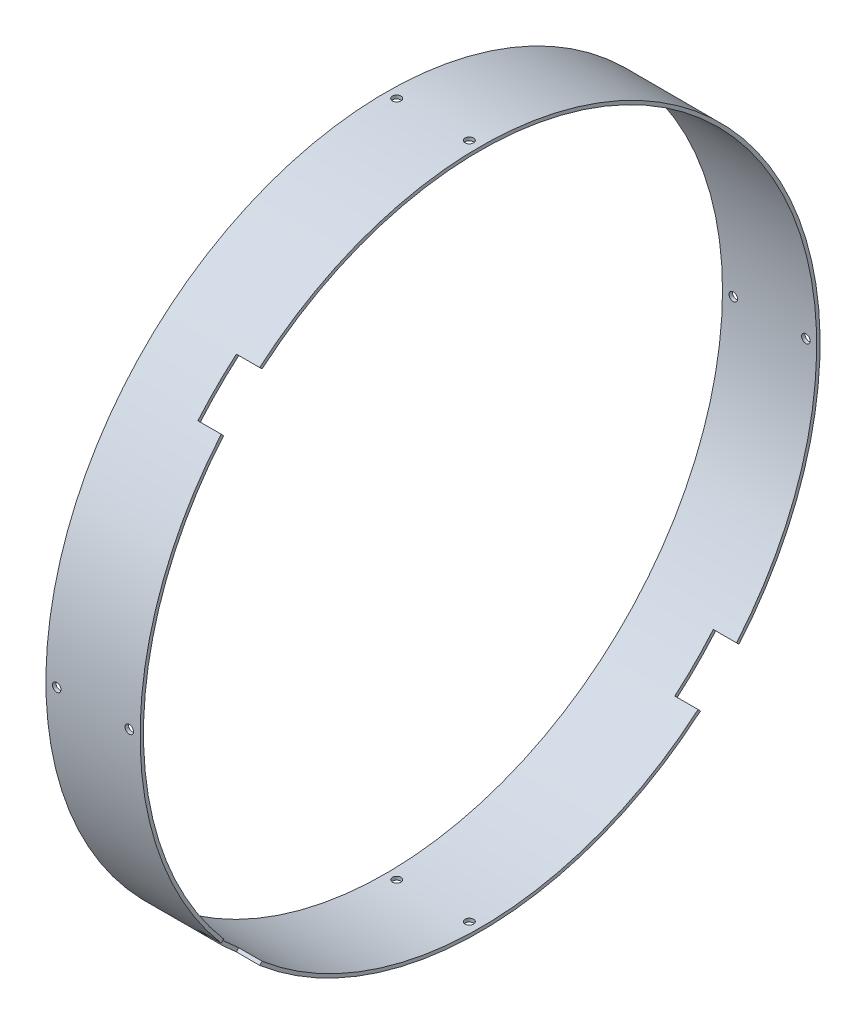
from build123d import *

# Parameters (mm, degrees)
SKETCH1_R               = 100
SKETCH1_R_2             = 99
BOSS_EXTRUDE1_DEPTH     = 27.7
F_2_5MM_DOWEL_HOLE1_D   = 2.5
F_2_5MM_DOWEL_HOLE2_D   = 2.5
SKETCH6_W               = 7.35
SKETCH6_H               = 16
CUT_EXTRUDE1_DEPTH      = 145.108605038
CUT_EXTRUDE2_DEPTH      = 145.108605038
CUT_EXTRUDE2_DEPTH_BACK = 145.108605038
SKETCH7_W               = 7.35
SKETCH7_H               = 16


with BuildPart() as part:
    # Sketch1 → Boss-Extrude1 (new body)
    with BuildSketch(Plane(origin=(0, 0, 0), x_dir=(0, 0, -1), z_dir=(1, 0, 0))):
        Circle(SKETCH1_R)
        Circle(SKETCH1_R_2, mode=Mode.SUBTRACT)
    extrude(amount=BOSS_EXTRUDE1_DEPTH)

    # Ø2.5mm Dowel Hole1 (through all)
    with Locations(Plane.XY.offset(100)):
        with Locations((24.525, 0), (3.175, 0)):
            Hole(F_2_5MM_DOWEL_HOLE1_D / 2)

    # Ø2.5mm Dowel Hole2 (through all)
    with Locations(Plane(origin=(0, 100, 0), x_dir=(1, 0, 0), z_dir=(0, 1, 0))):
        with Locations((24.525, 0), (3.175, 0)):
            Hole(F_2_5MM_DOWEL_HOLE2_D / 2)

    # Sketch6 → Cut-Extrude1 (cut, through all)
    with BuildSketch(Plane(origin=(0, 0, 0), x_dir=(-1, 0, 0), z_dir=(0, 0.7071067811865475, -0.7071067811865477))):
        with Locations((-24.525, 0)):
            Rectangle(SKETCH6_W, SKETCH6_H)
    extrude(amount=-CUT_EXTRUDE1_DEPTH, mode=Mode.SUBTRACT)

    # Sketch7 → Cut-Extrude2 (cut, two sides: drawn at the far end of the back side and taken through both)
    with BuildSketch(Plane(origin=(0, 0, 0), x_dir=(-1, 0, 0), z_dir=(0, 0.7071067811865476, 0.7071067811865476)).offset(-CUT_EXTRUDE2_DEPTH_BACK)):
        with Locations((-24.525, 0)):
            Rectangle(SKETCH7_W, SKETCH7_H)
    extrude(amount=CUT_EXTRUDE2_DEPTH + CUT_EXTRUDE2_DEPTH_BACK, mode=Mode.SUBTRACT)


solid = part.part
